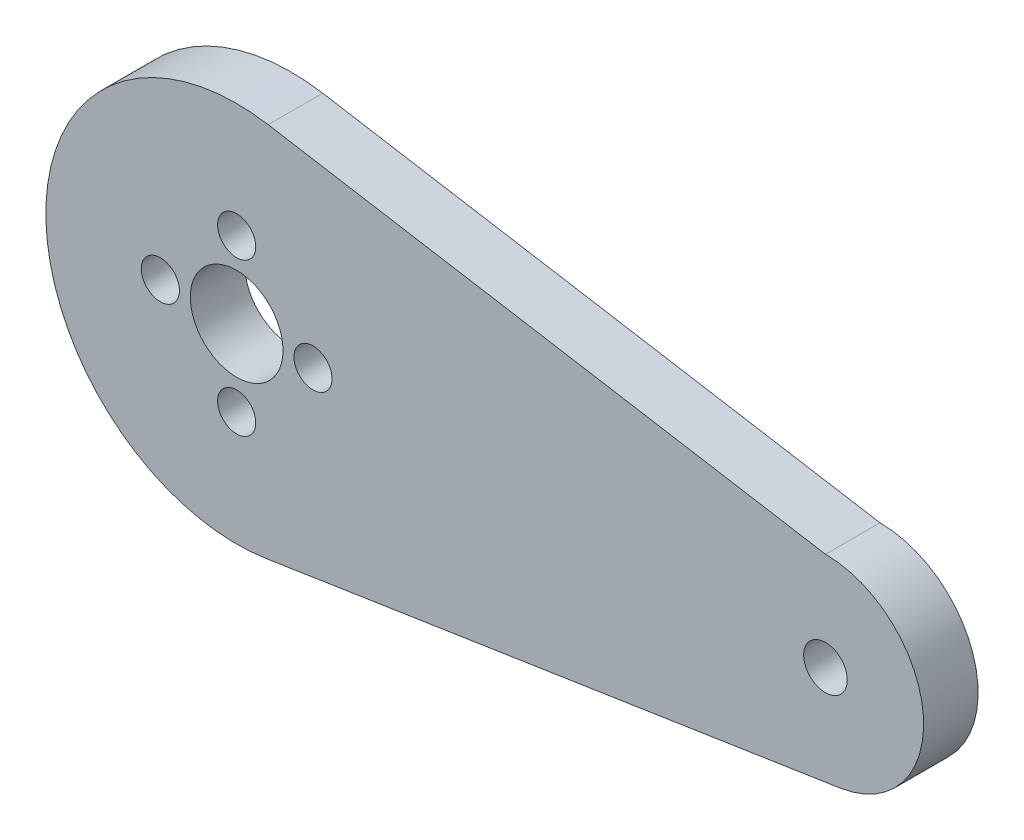
from build123d import *

# Parameters (mm, degrees)
SKETCH2_R           = 4.25
SKETCH2_R_2         = 2
BOSS_EXTRUDE1_DEPTH = 5
SKETCH_1_R          = 1.75
CUT_EXTRUDE_1_DEPTH = 10


with BuildPart() as part:
    # Sketch2 → Boss-Extrude1 (new body)
    with BuildSketch(Plane.XY):
        with BuildLine():
            Line((-17.328874887, 74.839530577), (33.78000003, 66.278338859))
            ThreePointArc((33.78000003, 66.278338859), (42.753857637, 57.963816533), (35.14697315, 48.382756557))
            Line((35.14697315, 48.382756557), (-17.561996681, 40.283034413))
            ThreePointArc((-17.561996681, 40.283034413), (-37.719601772, 57.698054173), (-17.328874887, 74.839530577))
        make_face()
        with Locations((-20.21999997, 57.58)):
            Circle(SKETCH2_R, mode=Mode.SUBTRACT)
        with Locations((33.78000003, 57.278338859)):
            Circle(SKETCH2_R_2, mode=Mode.SUBTRACT)
    extrude(amount=-BOSS_EXTRUDE1_DEPTH)

    # 草图1 → 切除-拉伸1 (cut)
    with BuildSketch(Plane.XY):
        with Locations((-13.21999997, 57.58)):
            Circle(SKETCH_1_R)
        with Locations((-27.21999997, 57.58)):
            Circle(SKETCH_1_R)
        with Locations((-20.21999997, 64.58)):
            Circle(SKETCH_1_R)
        with Locations((-20.21999997, 50.58)):
            Circle(SKETCH_1_R)
    extrude(amount=-CUT_EXTRUDE_1_DEPTH, mode=Mode.SUBTRACT)


solid = part.part
